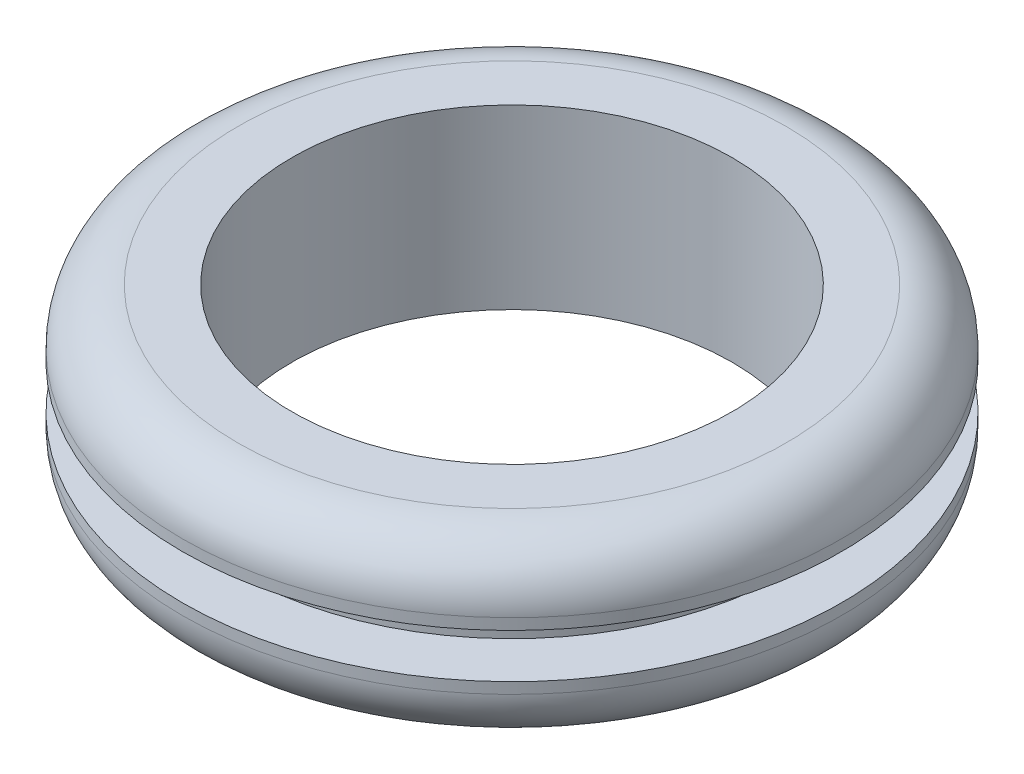
from build123d import *


with BuildPart() as part:
    # Esquisse2 → Révolution1 (revolve)
    with BuildSketch(Plane.XY, mode=Mode.PRIVATE) as r_volution1_sk:
        with BuildLine():
            Line((7.95, 3.2), (7.95, 0))
            Line((7.95, 0), (10, 0))
            Line((10, 0), (10, 0.8))
            Line((10, 0.8), (11.9, 0.8))
            Line((11.9, 0.8), (11.9, 1.2))
            ThreePointArc((11.9, 1.2), (11.314213562, 2.614213562), (9.9, 3.2))
            Line((9.9, 3.2), (7.95, 3.2))
        make_face()
    r_volution1 = revolve(r_volution1_sk.sketch.rotate(Axis((0, 0, 0), (0, 1, 0)), 90), axis=Axis((0, 0, 0), (0, 1, 0)))

    # Symétrie1: Révolution1 across plane
    add(r_volution1.mirror(Plane.ZX))


solid = part.part
